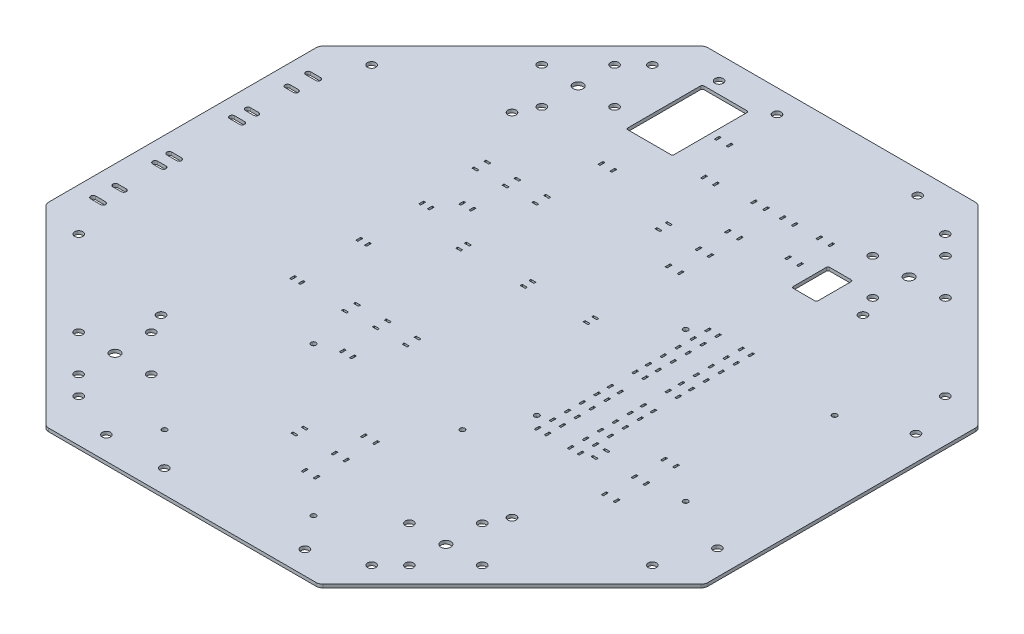
from build123d import *

# Parameters (mm, degrees)
SKETCH_1_R      = 2.5
SKETCH_1_R_2    = 1.5
SKETCH_1_R_3    = 3
SKETCH_1_W      = 3
SKETCH_1_H      = 1.2
SKETCH_1_W_2    = 1.2
SKETCH_1_H_2    = 3
SKETCH_1_H_3    = 2.999999999
EXTRUDE_1_DEPTH = 2


with BuildPart() as part:
    # 草图1 → 凸台-拉伸1 (new body)
    with BuildSketch(Plane.XZ):
        with BuildLine():
            Line((-199.172618896, 80.843145751), (-199.172618896, -80.843145751))
            ThreePointArc((-199.172618896, -80.843145751), (-198.868137026, -82.37387948), (-198.001046021, -83.671572875))
            Line((-198.001046021, -83.671572875), (-83.671572875, -198.001046021))
            ThreePointArc((-83.671572875, -198.001046021), (-82.37387948, -198.868137026), (-80.843145751, -199.172618896))
            Line((-80.843145751, -199.172618896), (80.84314575, -199.172618896))
            ThreePointArc((80.84314575, -199.172618896), (82.37387948, -198.868137026), (83.671572875, -198.001046021))
            Line((83.671572875, -198.001046021), (198.001046021, -83.671572875))
            ThreePointArc((198.001046021, -83.671572875), (198.868137026, -82.37387948), (199.172618896, -80.843145751))
            Line((199.172618896, -80.843145751), (199.172618896, 80.843145751))
            ThreePointArc((199.172618896, 80.843145751), (198.868137026, 82.37387948), (198.001046021, 83.671572875))
            Line((198.001046021, 83.671572875), (83.671572875, 198.001046021))
            ThreePointArc((83.671572875, 198.001046021), (82.37387948, 198.868137026), (80.84314575, 199.172618896))
            Line((80.84314575, 199.172618896), (-80.843145751, 199.172618896))
            ThreePointArc((-80.843145751, 199.172618896), (-82.37387948, 198.868137026), (-83.671572875, 198.001046021))
            Line((-83.671572875, 198.001046021), (-198.001046021, 83.671572875))
            ThreePointArc((-198.001046021, 83.671572875), (-198.868137026, 82.37387948), (-199.172618896, 80.843145751))
        make_face()
        with Locations((-106.066017178, -106.066017178)):
            Circle(SKETCH_1_R, mode=Mode.SUBTRACT)
        with Locations((106.066017178, -106.066017178)):
            Circle(SKETCH_1_R, mode=Mode.SUBTRACT)
        with Locations((-106.066017178, 106.066017178)):
            Circle(SKETCH_1_R, mode=Mode.SUBTRACT)
        with Locations((106.066017178, 106.066017178)):
            Circle(SKETCH_1_R, mode=Mode.SUBTRACT)
        with Locations((-60, 185.172618896)):
            Circle(SKETCH_1_R, mode=Mode.SUBTRACT)
        with Locations((60, 185.172618896)):
            Circle(SKETCH_1_R, mode=Mode.SUBTRACT)
        with Locations((-60, -185.172618896)):
            Circle(SKETCH_1_R, mode=Mode.SUBTRACT)
        with Locations((60, -185.172618896)):
            Circle(SKETCH_1_R, mode=Mode.SUBTRACT)
        with Locations((184.172618896, -60)):
            Circle(SKETCH_1_R, mode=Mode.SUBTRACT)
        with Locations((184.172618896, 60)):
            Circle(SKETCH_1_R, mode=Mode.SUBTRACT)
        with Locations((-88.51040764, 173.363221383)):
            Circle(SKETCH_1_R, mode=Mode.SUBTRACT)
        with Locations((-173.363221383, 88.51040764)):
            Circle(SKETCH_1_R, mode=Mode.SUBTRACT)
        with Locations((173.363221383, -88.51040764)):
            Circle(SKETCH_1_R, mode=Mode.SUBTRACT)
        with Locations((88.51040764, -173.363221383)):
            Circle(SKETCH_1_R, mode=Mode.SUBTRACT)
        with Locations((-173.363221383, -88.51040764)):
            Circle(SKETCH_1_R, mode=Mode.SUBTRACT)
        with Locations((-88.51040764, -173.363221383)):
            Circle(SKETCH_1_R, mode=Mode.SUBTRACT)
        with Locations((88.51040764, 173.363221383)):
            Circle(SKETCH_1_R, mode=Mode.SUBTRACT)
        with Locations((173.363221383, 88.51040764)):
            Circle(SKETCH_1_R, mode=Mode.SUBTRACT)
        with Locations((-78, -140)):
            Circle(SKETCH_1_R, mode=Mode.SUBTRACT)
        with Locations((-100, -162)):
            Circle(SKETCH_1_R, mode=Mode.SUBTRACT)
        with Locations((-100, -118)):
            Circle(SKETCH_1_R, mode=Mode.SUBTRACT)
        with Locations((-78, 140)):
            Circle(SKETCH_1_R, mode=Mode.SUBTRACT)
        with Locations((-100, 162)):
            Circle(SKETCH_1_R, mode=Mode.SUBTRACT)
        with Locations((-100, 118)):
            Circle(SKETCH_1_R, mode=Mode.SUBTRACT)
        with Locations((78, 140)):
            Circle(SKETCH_1_R, mode=Mode.SUBTRACT)
        with Locations((100, 162)):
            Circle(SKETCH_1_R, mode=Mode.SUBTRACT)
        with Locations((100, 118)):
            Circle(SKETCH_1_R, mode=Mode.SUBTRACT)
        with Locations((78, -140)):
            Circle(SKETCH_1_R, mode=Mode.SUBTRACT)
        with Locations((100, -162)):
            Circle(SKETCH_1_R, mode=Mode.SUBTRACT)
        with Locations((100, -118)):
            Circle(SKETCH_1_R, mode=Mode.SUBTRACT)
        with Locations((-122, -140)):
            Circle(SKETCH_1_R, mode=Mode.SUBTRACT)
        with Locations((-122, 140)):
            Circle(SKETCH_1_R, mode=Mode.SUBTRACT)
        with Locations((122, 140)):
            Circle(SKETCH_1_R, mode=Mode.SUBTRACT)
        with Locations((122, -140)):
            Circle(SKETCH_1_R, mode=Mode.SUBTRACT)
        with Locations((-25, 185.172618896)):
            Circle(SKETCH_1_R, mode=Mode.SUBTRACT)
        with Locations((-25, -185.172618896)):
            Circle(SKETCH_1_R, mode=Mode.SUBTRACT)
        with Locations((150, 45)):
            Circle(SKETCH_1_R_2, mode=Mode.SUBTRACT)
        with Locations((150, -45)):
            Circle(SKETCH_1_R_2, mode=Mode.SUBTRACT)
        with Locations((60, -45)):
            Circle(SKETCH_1_R_2, mode=Mode.SUBTRACT)
        with Locations((60, 45)):
            Circle(SKETCH_1_R_2, mode=Mode.SUBTRACT)
        with Locations((45, 165)):
            Circle(SKETCH_1_R_2, mode=Mode.SUBTRACT)
        with Locations((45, 75)):
            Circle(SKETCH_1_R_2, mode=Mode.SUBTRACT)
        with Locations((-45, 75)):
            Circle(SKETCH_1_R_2, mode=Mode.SUBTRACT)
        with Locations((-45, 165)):
            Circle(SKETCH_1_R_2, mode=Mode.SUBTRACT)
        with Locations((-100, -140)):
            Circle(SKETCH_1_R_3, mode=Mode.SUBTRACT)
        with Locations((-100, 140)):
            Circle(SKETCH_1_R_3, mode=Mode.SUBTRACT)
        with Locations((100, 140)):
            Circle(SKETCH_1_R_3, mode=Mode.SUBTRACT)
        with Locations((100, -140)):
            Circle(SKETCH_1_R_3, mode=Mode.SUBTRACT)
        with BuildLine():
            Line((-182.172618896, 63.5), (-188.172618896, 63.5))
            ThreePointArc((-188.172618896, 63.5), (-189.672618896, 65), (-188.172618896, 66.5))
            Line((-188.172618896, 66.5), (-182.172618896, 66.5))
            ThreePointArc((-182.172618896, 66.5), (-180.672618896, 65), (-182.172618896, 63.5))
        make_face(mode=Mode.SUBTRACT)
        with BuildLine():
            Line((-182.172618896, 17.5), (-188.172618896, 17.5))
            ThreePointArc((-188.172618896, 17.5), (-189.672618896, 19), (-188.172618896, 20.5))
            Line((-188.172618896, 20.5), (-182.172618896, 20.5))
            ThreePointArc((-182.172618896, 20.5), (-180.672618896, 19), (-182.172618896, 17.5))
        make_face(mode=Mode.SUBTRACT)
        with BuildLine():
            Line((-182.172618896, -66.5), (-188.172618896, -66.5))
            ThreePointArc((-188.172618896, -66.5), (-189.672618896, -65), (-188.172618896, -63.5))
            Line((-188.172618896, -63.5), (-182.172618896, -63.5))
            ThreePointArc((-182.172618896, -63.5), (-180.672618896, -65), (-182.172618896, -66.5))
        make_face(mode=Mode.SUBTRACT)
        with BuildLine():
            Line((-182.172618896, -20.5), (-188.172618896, -20.5))
            ThreePointArc((-188.172618896, -20.5), (-189.672618896, -19), (-188.172618896, -17.5))
            Line((-188.172618896, -17.5), (-182.172618896, -17.5))
            ThreePointArc((-182.172618896, -17.5), (-180.672618896, -19), (-182.172618896, -20.5))
        make_face(mode=Mode.SUBTRACT)
        with BuildLine():
            Line((-187.672618896, 53.5), (-182.672618896, 53.5))
            ThreePointArc((-182.672618896, 53.5), (-181.172618896, 52), (-182.672618896, 50.5))
            Line((-182.672618896, 50.5), (-187.672618896, 50.5))
            ThreePointArc((-187.672618896, 50.5), (-189.172618896, 52), (-187.672618896, 53.5))
        make_face(mode=Mode.SUBTRACT)
        with BuildLine():
            Line((-187.672618896, 29.5), (-182.672618896, 29.5))
            ThreePointArc((-182.672618896, 29.5), (-181.172618896, 28), (-182.672618896, 26.5))
            Line((-182.672618896, 26.5), (-187.672618896, 26.5))
            ThreePointArc((-187.672618896, 26.5), (-189.172618896, 28), (-187.672618896, 29.5))
        make_face(mode=Mode.SUBTRACT)
        with BuildLine():
            Line((-187.672618896, -50.5), (-182.672618896, -50.5))
            ThreePointArc((-182.672618896, -50.5), (-181.172618896, -52), (-182.672618896, -53.5))
            Line((-182.672618896, -53.5), (-187.672618896, -53.5))
            ThreePointArc((-187.672618896, -53.5), (-189.172618896, -52), (-187.672618896, -50.5))
        make_face(mode=Mode.SUBTRACT)
        with BuildLine():
            Line((-187.672618896, -26.5), (-182.672618896, -26.5))
            ThreePointArc((-182.672618896, -26.5), (-181.172618896, -28), (-182.672618896, -29.5))
            Line((-182.672618896, -29.5), (-187.672618896, -29.5))
            ThreePointArc((-187.672618896, -29.5), (-189.172618896, -28), (-187.672618896, -26.5))
        make_face(mode=Mode.SUBTRACT)
        with Locations((-51.5, -65.6)):
            Rectangle(SKETCH_1_W, SKETCH_1_H, mode=Mode.SUBTRACT)
        with Locations((-69.5, -65.6)):
            Rectangle(SKETCH_1_W, SKETCH_1_H, mode=Mode.SUBTRACT)
        with Locations((-67.4, -43.5)):
            Rectangle(SKETCH_1_W_2, SKETCH_1_H_2, mode=Mode.SUBTRACT)
        with Locations((-51.5, -72.8)):
            Rectangle(SKETCH_1_W, SKETCH_1_H, mode=Mode.SUBTRACT)
        with Locations((-69.5, -72.8)):
            Rectangle(SKETCH_1_W, SKETCH_1_H, mode=Mode.SUBTRACT)
        with Locations((-87.5, -65.407159324)):
            Rectangle(SKETCH_1_W, SKETCH_1_H, mode=Mode.SUBTRACT)
        with Locations((-87.5, -72.607159324)):
            Rectangle(SKETCH_1_W, SKETCH_1_H, mode=Mode.SUBTRACT)
        with Locations((-16.5, 47.8)):
            Rectangle(SKETCH_1_W, SKETCH_1_H, mode=Mode.SUBTRACT)
        with Locations((-34.5, 47.8)):
            Rectangle(SKETCH_1_W, SKETCH_1_H, mode=Mode.SUBTRACT)
        with Locations((-32.4, 69.9)):
            Rectangle(SKETCH_1_W_2, SKETCH_1_H_2, mode=Mode.SUBTRACT)
        with Locations((-16.5, 40.6)):
            Rectangle(SKETCH_1_W, SKETCH_1_H, mode=Mode.SUBTRACT)
        with Locations((-34.5, 40.6)):
            Rectangle(SKETCH_1_W, SKETCH_1_H, mode=Mode.SUBTRACT)
        with Locations((-52.5, 48.4)):
            Rectangle(SKETCH_1_W, SKETCH_1_H, mode=Mode.SUBTRACT)
        with Locations((-52.5, 41.2)):
            Rectangle(SKETCH_1_W, SKETCH_1_H, mode=Mode.SUBTRACT)
        with Locations((121.592840676, 65.5)):
            Rectangle(SKETCH_1_W_2, SKETCH_1_H_2, mode=Mode.SUBTRACT)
        with Locations((121.592840676, 47.5)):
            Rectangle(SKETCH_1_W_2, SKETCH_1_H_2, mode=Mode.SUBTRACT)
        with Locations((99.492840676, 49.6)):
            Rectangle(SKETCH_1_W, SKETCH_1_H, mode=Mode.SUBTRACT)
        with Locations((128.792840676, 65.5)):
            Rectangle(SKETCH_1_W_2, SKETCH_1_H_2, mode=Mode.SUBTRACT)
        with Locations((128.792840676, 47.5)):
            Rectangle(SKETCH_1_W_2, SKETCH_1_H_2, mode=Mode.SUBTRACT)
        with Locations((121.4, 29.5)):
            Rectangle(SKETCH_1_W_2, SKETCH_1_H_2, mode=Mode.SUBTRACT)
        with Locations((128.6, 29.5)):
            Rectangle(SKETCH_1_W_2, SKETCH_1_H_2, mode=Mode.SUBTRACT)
        with Locations((21.6, -73.1)):
            Rectangle(SKETCH_1_W_2, SKETCH_1_H_2, mode=Mode.SUBTRACT)
        with Locations((21.6, -91.1)):
            Rectangle(SKETCH_1_W_2, SKETCH_1_H_2, mode=Mode.SUBTRACT)
        with Locations((-0.5, -89)):
            Rectangle(SKETCH_1_W, SKETCH_1_H, mode=Mode.SUBTRACT)
        with Locations((28.8, -73.1)):
            Rectangle(SKETCH_1_W_2, SKETCH_1_H_2, mode=Mode.SUBTRACT)
        with Locations((28.8, -91.1)):
            Rectangle(SKETCH_1_W_2, SKETCH_1_H_2, mode=Mode.SUBTRACT)
        with Locations((21.407159324, -109.1)):
            Rectangle(SKETCH_1_W_2, SKETCH_1_H_2, mode=Mode.SUBTRACT)
        with Locations((28.607159324, -109.1)):
            Rectangle(SKETCH_1_W_2, SKETCH_1_H_2, mode=Mode.SUBTRACT)
        with Locations((18.6, 143.9)):
            Rectangle(SKETCH_1_W_2, SKETCH_1_H_2, mode=Mode.SUBTRACT)
        with Locations((18.6, 125.9)):
            Rectangle(SKETCH_1_W_2, SKETCH_1_H_2, mode=Mode.SUBTRACT)
        with Locations((-3.5, 128)):
            Rectangle(SKETCH_1_W, SKETCH_1_H, mode=Mode.SUBTRACT)
        with Locations((25.8, 143.9)):
            Rectangle(SKETCH_1_W_2, SKETCH_1_H_2, mode=Mode.SUBTRACT)
        with Locations((25.8, 125.9)):
            Rectangle(SKETCH_1_W_2, SKETCH_1_H_2, mode=Mode.SUBTRACT)
        with Locations((18.407159324, 107.9)):
            Rectangle(SKETCH_1_W_2, SKETCH_1_H_2, mode=Mode.SUBTRACT)
        with Locations((25.607159324, 107.9)):
            Rectangle(SKETCH_1_W_2, SKETCH_1_H_2, mode=Mode.SUBTRACT)
        with Locations((-3.5, 121.8)):
            Rectangle(SKETCH_1_W, SKETCH_1_H, mode=Mode.SUBTRACT)
        with Locations((-26.2, 69.9)):
            Rectangle(SKETCH_1_W_2, SKETCH_1_H_2, mode=Mode.SUBTRACT)
        with Locations((-73.6, -43.5)):
            Rectangle(SKETCH_1_W_2, SKETCH_1_H_2, mode=Mode.SUBTRACT)
        with Locations((-0.5, -95.2)):
            Rectangle(SKETCH_1_W, SKETCH_1_H, mode=Mode.SUBTRACT)
        with Locations((99.492840676, 42.4)):
            Rectangle(SKETCH_1_W, SKETCH_1_H, mode=Mode.SUBTRACT)
        with Locations((93, 51.5)):
            Rectangle(SKETCH_1_W_2, SKETCH_1_H_2, mode=Mode.SUBTRACT)
        with Locations((93, 42.5)):
            Rectangle(SKETCH_1_W_2, SKETCH_1_H_2, mode=Mode.SUBTRACT)
        with Locations((93, 33.5)):
            Rectangle(SKETCH_1_W_2, SKETCH_1_H_2, mode=Mode.SUBTRACT)
        with Locations((93, 24.5)):
            Rectangle(SKETCH_1_W_2, SKETCH_1_H_2, mode=Mode.SUBTRACT)
        with Locations((93, 15.5)):
            Rectangle(SKETCH_1_W_2, SKETCH_1_H_2, mode=Mode.SUBTRACT)
        with Locations((93, 7.5)):
            Rectangle(SKETCH_1_W_2, SKETCH_1_H_2, mode=Mode.SUBTRACT)
        with Locations((93, -51.5)):
            Rectangle(SKETCH_1_W_2, SKETCH_1_H_2, mode=Mode.SUBTRACT)
        with Locations((93, -42.5)):
            Rectangle(SKETCH_1_W_2, SKETCH_1_H_2, mode=Mode.SUBTRACT)
        with Locations((93, -33.5)):
            Rectangle(SKETCH_1_W_2, SKETCH_1_H_2, mode=Mode.SUBTRACT)
        with Locations((93, -24.5)):
            Rectangle(SKETCH_1_W_2, SKETCH_1_H_2, mode=Mode.SUBTRACT)
        with Locations((93, -15.5)):
            Rectangle(SKETCH_1_W_2, SKETCH_1_H_2, mode=Mode.SUBTRACT)
        with Locations((93, -7.5)):
            Rectangle(SKETCH_1_W_2, SKETCH_1_H_2, mode=Mode.SUBTRACT)
        with Locations((87, -51.5)):
            Rectangle(SKETCH_1_W_2, SKETCH_1_H_2, mode=Mode.SUBTRACT)
        with Locations((87, -42.5)):
            Rectangle(SKETCH_1_W_2, SKETCH_1_H_2, mode=Mode.SUBTRACT)
        with Locations((87, -33.5)):
            Rectangle(SKETCH_1_W_2, SKETCH_1_H_2, mode=Mode.SUBTRACT)
        with Locations((87, -24.5)):
            Rectangle(SKETCH_1_W_2, SKETCH_1_H_2, mode=Mode.SUBTRACT)
        with Locations((87, -15.5)):
            Rectangle(SKETCH_1_W_2, SKETCH_1_H_2, mode=Mode.SUBTRACT)
        with Locations((87, -7.5)):
            Rectangle(SKETCH_1_W_2, SKETCH_1_H_2, mode=Mode.SUBTRACT)
        with Locations((87, 51.5)):
            Rectangle(SKETCH_1_W_2, SKETCH_1_H_2, mode=Mode.SUBTRACT)
        with Locations((87, 42.5)):
            Rectangle(SKETCH_1_W_2, SKETCH_1_H_2, mode=Mode.SUBTRACT)
        with Locations((87, 33.5)):
            Rectangle(SKETCH_1_W_2, SKETCH_1_H_2, mode=Mode.SUBTRACT)
        with Locations((87, 24.5)):
            Rectangle(SKETCH_1_W_2, SKETCH_1_H_2, mode=Mode.SUBTRACT)
        with Locations((87, 15.5)):
            Rectangle(SKETCH_1_W_2, SKETCH_1_H_2, mode=Mode.SUBTRACT)
        with Locations((87, 7.5)):
            Rectangle(SKETCH_1_W_2, SKETCH_1_H_2, mode=Mode.SUBTRACT)
        with Locations((67, 51.5)):
            Rectangle(SKETCH_1_W_2, SKETCH_1_H_2, mode=Mode.SUBTRACT)
        with Locations((67, 42.5)):
            Rectangle(SKETCH_1_W_2, SKETCH_1_H_2, mode=Mode.SUBTRACT)
        with Locations((67, 33.5)):
            Rectangle(SKETCH_1_W_2, SKETCH_1_H_2, mode=Mode.SUBTRACT)
        with Locations((67, 24.5)):
            Rectangle(SKETCH_1_W_2, SKETCH_1_H_2, mode=Mode.SUBTRACT)
        with Locations((67, 15.5)):
            Rectangle(SKETCH_1_W_2, SKETCH_1_H_2, mode=Mode.SUBTRACT)
        with Locations((67, 7.5)):
            Rectangle(SKETCH_1_W_2, SKETCH_1_H_2, mode=Mode.SUBTRACT)
        with Locations((67, -51.5)):
            Rectangle(SKETCH_1_W_2, SKETCH_1_H_2, mode=Mode.SUBTRACT)
        with Locations((67, -42.5)):
            Rectangle(SKETCH_1_W_2, SKETCH_1_H_2, mode=Mode.SUBTRACT)
        with Locations((67, -33.5)):
            Rectangle(SKETCH_1_W_2, SKETCH_1_H_2, mode=Mode.SUBTRACT)
        with Locations((67, -24.5)):
            Rectangle(SKETCH_1_W_2, SKETCH_1_H_2, mode=Mode.SUBTRACT)
        with Locations((67, -15.5)):
            Rectangle(SKETCH_1_W_2, SKETCH_1_H_2, mode=Mode.SUBTRACT)
        with Locations((67, -7.5)):
            Rectangle(SKETCH_1_W_2, SKETCH_1_H_2, mode=Mode.SUBTRACT)
        with Locations((73, -51.5)):
            Rectangle(SKETCH_1_W_2, SKETCH_1_H_2, mode=Mode.SUBTRACT)
        with Locations((73, -42.5)):
            Rectangle(SKETCH_1_W_2, SKETCH_1_H_2, mode=Mode.SUBTRACT)
        with Locations((73, -33.5)):
            Rectangle(SKETCH_1_W_2, SKETCH_1_H_2, mode=Mode.SUBTRACT)
        with Locations((73, -24.5)):
            Rectangle(SKETCH_1_W_2, SKETCH_1_H_2, mode=Mode.SUBTRACT)
        with Locations((73, -15.5)):
            Rectangle(SKETCH_1_W_2, SKETCH_1_H_2, mode=Mode.SUBTRACT)
        with Locations((73, -7.5)):
            Rectangle(SKETCH_1_W_2, SKETCH_1_H_2, mode=Mode.SUBTRACT)
        with Locations((73, 51.5)):
            Rectangle(SKETCH_1_W_2, SKETCH_1_H_2, mode=Mode.SUBTRACT)
        with Locations((73, 42.5)):
            Rectangle(SKETCH_1_W_2, SKETCH_1_H_2, mode=Mode.SUBTRACT)
        with Locations((73, 33.5)):
            Rectangle(SKETCH_1_W_2, SKETCH_1_H_2, mode=Mode.SUBTRACT)
        with Locations((73, 24.5)):
            Rectangle(SKETCH_1_W_2, SKETCH_1_H_2, mode=Mode.SUBTRACT)
        with Locations((73, 15.5)):
            Rectangle(SKETCH_1_W_2, SKETCH_1_H_2, mode=Mode.SUBTRACT)
        with Locations((73, 7.5)):
            Rectangle(SKETCH_1_W_2, SKETCH_1_H_2, mode=Mode.SUBTRACT)
        with Locations((-80.6, 46.5)):
            Rectangle(SKETCH_1_W_2, SKETCH_1_H_2, mode=Mode.SUBTRACT)
        with Locations((-85.8, 46.5)):
            Rectangle(SKETCH_1_W_2, SKETCH_1_H_2, mode=Mode.SUBTRACT)
        with Locations((-80.6, 6.5)):
            Rectangle(SKETCH_1_W_2, SKETCH_1_H_2, mode=Mode.SUBTRACT)
        with Locations((-85.8, 6.5)):
            Rectangle(SKETCH_1_W_2, SKETCH_1_H_2, mode=Mode.SUBTRACT)
        with Locations((-80.6, -31.5)):
            Rectangle(SKETCH_1_W_2, SKETCH_1_H_2, mode=Mode.SUBTRACT)
        with Locations((-85.8, -31.5)):
            Rectangle(SKETCH_1_W_2, SKETCH_1_H_2, mode=Mode.SUBTRACT)
        with Locations((26.5, -18.6)):
            Rectangle(SKETCH_1_W, SKETCH_1_H, mode=Mode.SUBTRACT)
        with Locations((26.5, -23.8)):
            Rectangle(SKETCH_1_W, SKETCH_1_H, mode=Mode.SUBTRACT)
        with Locations((-11.5, -18.6)):
            Rectangle(SKETCH_1_W, SKETCH_1_H, mode=Mode.SUBTRACT)
        with Locations((-11.5, -23.8)):
            Rectangle(SKETCH_1_W, SKETCH_1_H, mode=Mode.SUBTRACT)
        with Locations((-50.5, -23.8)):
            Rectangle(SKETCH_1_W, SKETCH_1_H, mode=Mode.SUBTRACT)
        with Locations((-50.5, -18.6)):
            Rectangle(SKETCH_1_W, SKETCH_1_H, mode=Mode.SUBTRACT)
        with BuildLine():
            Line((71, -99), (84, -99))
            ThreePointArc((84, -99), (84.707106781, -99.292893219), (85, -100))
            Line((85, -100), (85, -120))
            ThreePointArc((85, -120), (84.707106781, -120.707106781), (84, -121))
            Line((84, -121), (71, -121))
            ThreePointArc((71, -121), (70.292893219, -120.707106781), (70, -120))
            Line((70, -120), (70, -100))
            ThreePointArc((70, -100), (70.292893219, -99.292893219), (71, -99))
        make_face(mode=Mode.SUBTRACT)
        with BuildLine():
            Line((-62, -132), (-36, -132))
            ThreePointArc((-36, -132), (-35.292893219, -132.292893219), (-35, -133))
            Line((-35, -133), (-35, -177))
            ThreePointArc((-35, -177), (-35.292893219, -177.707106781), (-36, -178))
            Line((-36, -178), (-62, -178))
            ThreePointArc((-62, -178), (-62.707106781, -177.707106781), (-63, -177))
            Line((-63, -177), (-63, -133))
            ThreePointArc((-63, -133), (-62.707106781, -132.292893219), (-62, -132))
        make_face(mode=Mode.SUBTRACT)
        with Locations((60.6, -113.5)):
            Rectangle(SKETCH_1_W_2, SKETCH_1_H_2, mode=Mode.SUBTRACT)
        with Locations((53.4, -113.5)):
            Rectangle(SKETCH_1_W_2, SKETCH_1_H_2, mode=Mode.SUBTRACT)
        with Locations((59.628450691, -133.317307922)):
            Rectangle(SKETCH_1_W_2, SKETCH_1_H_3, mode=Mode.SUBTRACT)
        with Locations((52.428450691, -133.317307922)):
            Rectangle(SKETCH_1_W_2, SKETCH_1_H_3, mode=Mode.SUBTRACT)
        with Locations((38.022293986, -132.822800814)):
            Rectangle(SKETCH_1_W_2, SKETCH_1_H_2, mode=Mode.SUBTRACT)
        with Locations((30.822293986, -132.822800814)):
            Rectangle(SKETCH_1_W_2, SKETCH_1_H_2, mode=Mode.SUBTRACT)
        with Locations((21.093576763, -132.449203411)):
            Rectangle(SKETCH_1_W_2, SKETCH_1_H_2, mode=Mode.SUBTRACT)
        with Locations((13.893576763, -132.449203411)):
            Rectangle(SKETCH_1_W_2, SKETCH_1_H_2, mode=Mode.SUBTRACT)
        with Locations((-7.004460557, -130.264677507)):
            Rectangle(SKETCH_1_W_2, SKETCH_1_H_2, mode=Mode.SUBTRACT)
        with Locations((-14.204460557, -130.264677507)):
            Rectangle(SKETCH_1_W_2, SKETCH_1_H_2, mode=Mode.SUBTRACT)
        with Locations((-23.171039078, -154.718325689)):
            Rectangle(SKETCH_1_W_2, SKETCH_1_H_2, mode=Mode.SUBTRACT)
        with Locations((-30.371039078, -154.718325689)):
            Rectangle(SKETCH_1_W_2, SKETCH_1_H_2, mode=Mode.SUBTRACT)
        with Locations((-45.145359042, -106.422370529)):
            Rectangle(SKETCH_1_W_2, SKETCH_1_H_2, mode=Mode.SUBTRACT)
        with Locations((-52.345359042, -106.422370529)):
            Rectangle(SKETCH_1_W_2, SKETCH_1_H_2, mode=Mode.SUBTRACT)
    extrude(amount=-EXTRUDE_1_DEPTH)


solid = part.part
